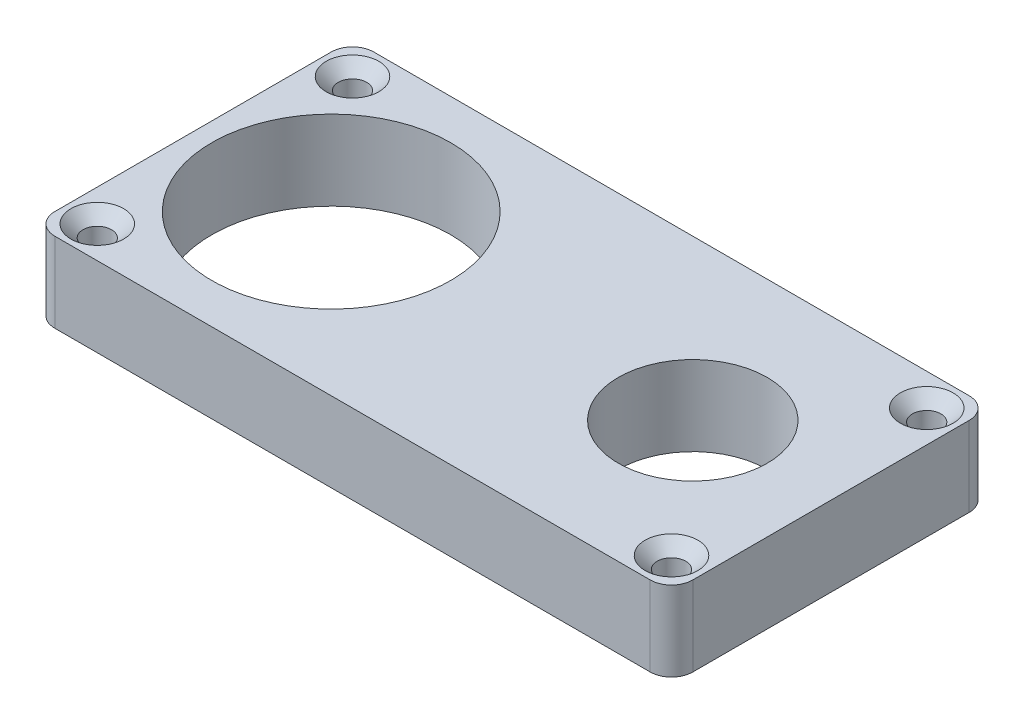
from build123d import *

# Parameters (mm, degrees)
SKETCH1_R                                       = 8.89
SKETCH1_R_2                                     = 14.265
BOSS_EXTRUDE1_DEPTH                             = 9.525
CSK_FOR_M3_FLAT_HEAD_MACHINE_SCREW1_D           = 3.4
CSK_FOR_M3_FLAT_HEAD_MACHINE_SCREW1_DEPTH       = 9.99998
CSK_FOR_M3_FLAT_HEAD_MACHINE_SCREW1_CSINK_D     = 6.3
CSK_FOR_M3_FLAT_HEAD_MACHINE_SCREW1_CSINK_ANGLE = 90
CSK_FOR_M3_FLAT_HEAD_MACHINE_SCREW1_TIP         = 1.021463052


with BuildPart() as part:
    # Sketch1 → Boss-Extrude1 (new body)
    with BuildSketch(Plane.XZ):
        with BuildLine():
            Line((-35.56, -19.05), (35.56, -19.05))
            ThreePointArc((35.56, -19.05), (37.356051224, -18.306051224), (38.1, -16.51))
            Line((38.1, -16.51), (38.1, 16.51))
            ThreePointArc((38.1, 16.51), (37.356051224, 18.306051224), (35.56, 19.05))
            Line((35.56, 19.05), (-35.56, 19.05))
            ThreePointArc((-35.56, 19.05), (-37.356051224, 18.306051224), (-38.1, 16.51))
            Line((-38.1, 16.51), (-38.1, -16.51))
            ThreePointArc((-38.1, -16.51), (-37.356051224, -18.306051224), (-35.56, -19.05))
        make_face()
        with Locations(Location((21.59, 0, 0), (0, 0, 270))):
            Circle(SKETCH1_R, mode=Mode.SUBTRACT)
        with Locations(Location((-21.59, 0, 0), (0, 0, 270))):
            Circle(SKETCH1_R_2, mode=Mode.SUBTRACT)
    extrude(amount=-BOSS_EXTRUDE1_DEPTH)

    # CSK for M3 Flat Head Machine Screw1
    with Locations(Plane(origin=(0, 9.525, 0), x_dir=(1, 0, 0), z_dir=(0, 1, 0))):
        with Locations((-34.29, 15.24), (-34.29, -15.24), (34.29, -15.24), (34.29, 15.24)):
            CounterSinkHole(CSK_FOR_M3_FLAT_HEAD_MACHINE_SCREW1_D / 2, CSK_FOR_M3_FLAT_HEAD_MACHINE_SCREW1_CSINK_D / 2, depth=CSK_FOR_M3_FLAT_HEAD_MACHINE_SCREW1_DEPTH, counter_sink_angle=CSK_FOR_M3_FLAT_HEAD_MACHINE_SCREW1_CSINK_ANGLE)
            with Locations((0, 0, -(CSK_FOR_M3_FLAT_HEAD_MACHINE_SCREW1_DEPTH + CSK_FOR_M3_FLAT_HEAD_MACHINE_SCREW1_TIP / 2))):  # 118° drill point
                Cone(0, CSK_FOR_M3_FLAT_HEAD_MACHINE_SCREW1_D / 2, CSK_FOR_M3_FLAT_HEAD_MACHINE_SCREW1_TIP, mode=Mode.SUBTRACT)


solid = part.part
